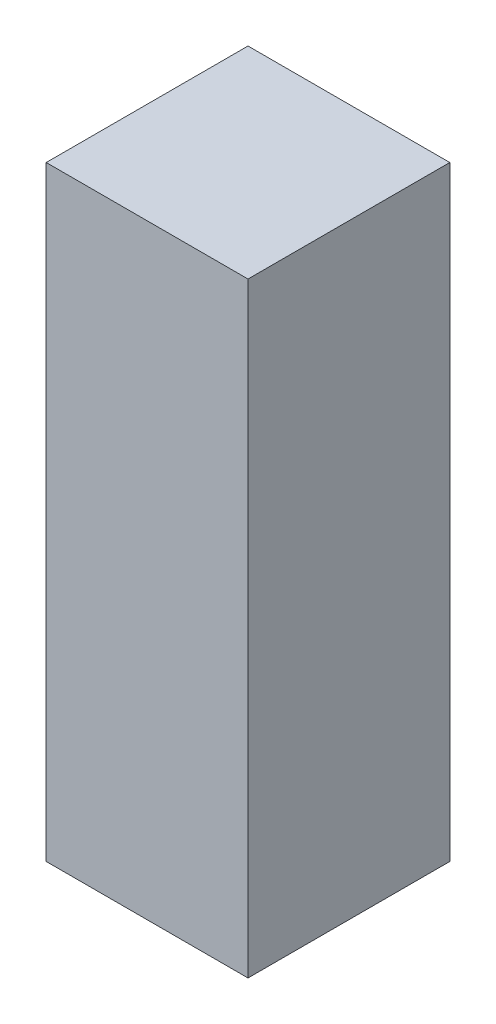
from build123d import *

# Parameters (mm, degrees)
SKETCH1_W           = 50.8
SKETCH1_H           = 50.8
BOSS_EXTRUDE1_DEPTH = 152.4


with BuildPart() as part:
    # Sketch1 → Boss-Extrude1 (new body)
    with BuildSketch(Plane(origin=(0, 0, 0), x_dir=(1, 0, 0), z_dir=(0, 1, 0))):
        with Locations((25.4, 25.4)):
            Rectangle(SKETCH1_W, SKETCH1_H)
    extrude(amount=BOSS_EXTRUDE1_DEPTH)


solid = part.part
